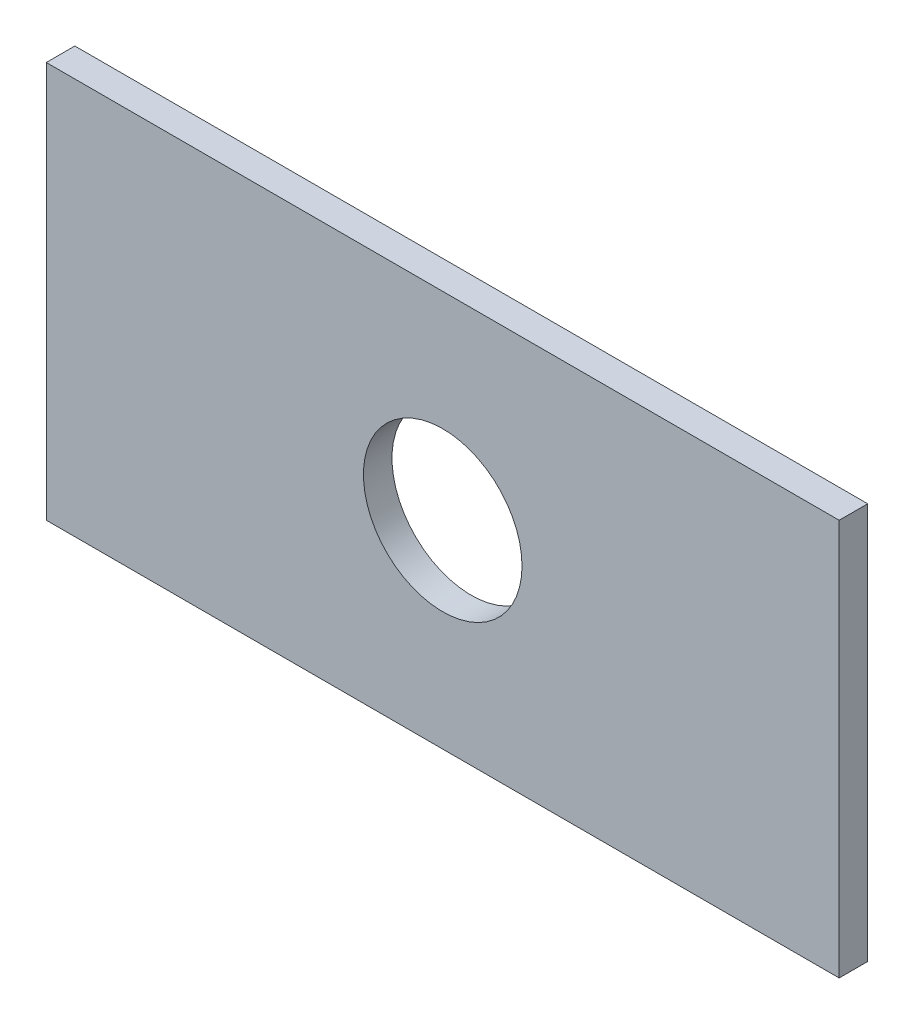
from build123d import *

# Parameters (mm, degrees)
ESBO_O1_W                = 50
ESBO_O1_H                = 25
RESSALTO_EXTRUS_O1_DEPTH = 1.8
ESBO_O2_R                = 5
CORTE_EXTRUS_O1_DEPTH    = 1.8


with BuildPart() as part:
    # Esboço1 → Ressalto-extrusão1 (new body)
    with BuildSketch(Plane.XY):
        Rectangle(ESBO_O1_W, ESBO_O1_H)
    extrude(amount=RESSALTO_EXTRUS_O1_DEPTH)

    # Esboço2 → Corte-extrusão1 (cut)
    with BuildSketch(Plane.XY.offset(1.8)):
        Circle(ESBO_O2_R)
    extrude(amount=-CORTE_EXTRUS_O1_DEPTH, mode=Mode.SUBTRACT)


solid = part.part
